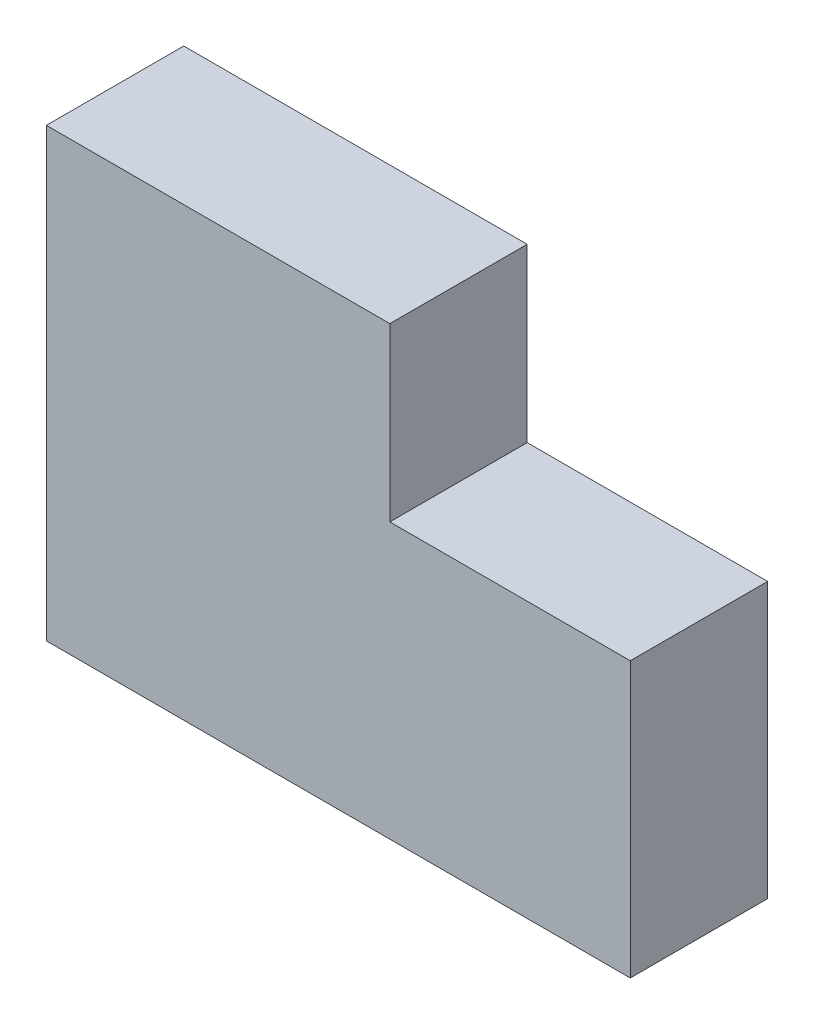
from build123d import *

# Parameters (mm, degrees)
SALIENTE_EXTRUIR1_DEPTH = 20


with BuildPart() as part:
    # Croquis1 → Saliente-Extruir1 (new body)
    with BuildSketch(Plane.XY):
        Polygon((0, 0), (85, 0), (85, 40), (50, 40), (50, 65), (0, 65), align=None)
    extrude(amount=SALIENTE_EXTRUIR1_DEPTH)


solid = part.part
